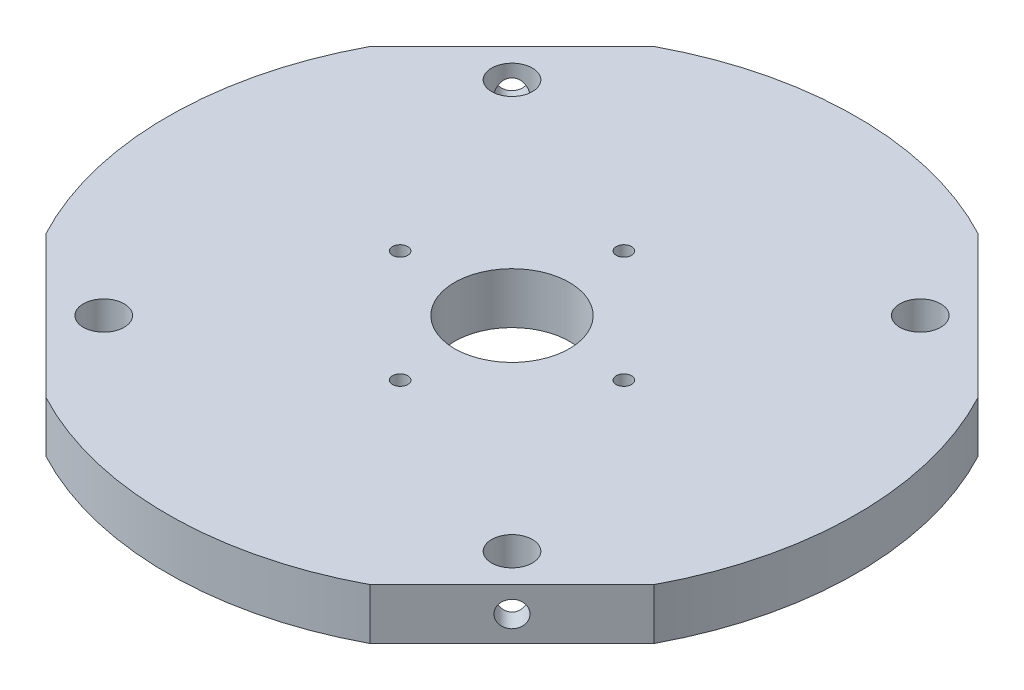
from build123d import *

# Parameters (mm, degrees)
SKETCH1_R                  = 67.5
BOSS_EXTRUDE1_DEPTH        = 10
CUT_EXTRUDE1_DEPTH         = 96.981769102
CUT_EXTRUDE1_DEPTH_BACK    = 96.981769102
SKETCH4_R                  = 4
CUT_EXTRUDE_THIN1_DEPTH    = 96.981769102
F_5_0MM_DOWEL_HOLE1_REACH  = 162.34
F_5_0MM_DOWEL_HOLE1_BORE_R = 2.5
CIRPATTERN1_COUNT          = 4
F_3_0MM_DOWEL_HOLE1_D      = 3
CUT_EXTRUDE2_DEPTH         = 96.981769113
CUT_EXTRUDE2_DEPTH_BACK    = 96.981769113
SKETCH13_R                 = 11.25


with BuildPart() as part:
    # Sketch1 → Boss-Extrude1 (new body)
    with BuildSketch(Plane(origin=(0, 0, 0), x_dir=(1, 0, 0), z_dir=(0, 1, 0))):
        with Locations(Location((0, 0, 0), (0, 0, 270))):
            Circle(SKETCH1_R)
    extrude(amount=BOSS_EXTRUDE1_DEPTH)

    # Sketch4 → Cut-Extrude1 (cut, two sides: drawn at the far end of the back side and taken through both)
    with BuildSketch(Plane(origin=(0, 10, 0), x_dir=(1, 0, 0), z_dir=(0, 1, 0)).offset(-CUT_EXTRUDE1_DEPTH_BACK)):
        with Locations(Location((-40, 40, 0), (0, 0, 270))):
            Circle(SKETCH4_R)
        with Locations(Location((40, 40, 0), (0, 0, 270))):
            Circle(SKETCH4_R)
        with Locations(Location((40, -40, 0), (0, 0, 270))):
            Circle(SKETCH4_R)
        with Locations(Location((-40, -40, 0), (0, 0, 270))):
            Circle(SKETCH4_R)
    extrude(amount=CUT_EXTRUDE1_DEPTH + CUT_EXTRUDE1_DEPTH_BACK, mode=Mode.SUBTRACT)

    # Sketch5 → Cut-Extrude-Thin1 (cut, through all)
    with BuildSketch(Plane(origin=(0, 10, 0), x_dir=(1, 0, 0), z_dir=(0, 1, 0))):
        Polygon((-31.743671291, 59.570037208), (-59.570037208, 31.743671291), (-66.64110502, 38.814739103), (-38.814739103, 66.64110502), align=None)
        Polygon((59.570037208, 31.743671291), (31.743671291, 59.570037208), (38.814739103, 66.64110502), (66.64110502, 38.814739103), align=None)
        Polygon((31.743671291, -59.570037208), (59.570037208, -31.743671291), (66.64110502, -38.814739103), (38.814739103, -66.64110502), align=None)
        Polygon((-59.570037208, -31.743671291), (-31.743671291, -59.570037208), (-38.814739103, -66.64110502), (-66.64110502, -38.814739103), align=None)
    extrude(amount=-CUT_EXTRUDE_THIN1_DEPTH, mode=Mode.SUBTRACT)

    # Ø5.0mm Dowel Hole1 bore → Ø5.0mm Dowel Hole1 (cut, up to next)
    with BuildSketch(Plane(origin=(45.656854249, 0, 45.656854249), x_dir=(0.7071067811865479, 0, -0.7071067811865471), z_dir=(0.7071067811865471, 0, 0.7071067811865479)), mode=Mode.PRIVATE) as f_5_0mm_dowel_hole1_sk1:
        with Locations((0, 5)):
            Circle(F_5_0MM_DOWEL_HOLE1_BORE_R)
    f_5_0mm_dowel_hole1_tool1 = extrude(f_5_0mm_dowel_hole1_sk1.sketch, amount=-F_5_0MM_DOWEL_HOLE1_REACH, mode=Mode.PRIVATE) & part.part
    f_5_0mm_dowel_hole1 = f_5_0mm_dowel_hole1_tool1.solids().sort_by_distance((45.656854, 5, 45.656854))[0]
    add(f_5_0mm_dowel_hole1, mode=Mode.SUBTRACT)

    # CirPattern1: Ø5.0mm Dowel Hole1 ×4 about axis
    cirpattern1_axis = Axis((0, 10, 0), (0, -1, 0))
    for i in range(1, CIRPATTERN1_COUNT):
        add(f_5_0mm_dowel_hole1.rotate(cirpattern1_axis, i * 360 / CIRPATTERN1_COUNT), mode=Mode.SUBTRACT)

    # Ø3.0mm Dowel Hole1 (through all)
    with Locations(Plane(origin=(0, 0, 0), x_dir=(-1, 0, 0), z_dir=(0, -1, 0))):
        with Locations((0, 21.920310217), (21.920310217, 0), (-21.920310217, 0), (0, -21.920310217)):
            Hole(F_3_0MM_DOWEL_HOLE1_D / 2)

    # Sketch13 → Cut-Extrude2 (cut, two sides: drawn at the far end of the back side and taken through both)
    with BuildSketch(Plane(origin=(0, 10, 0), x_dir=(1, 0, 0), z_dir=(0, 1, 0)).offset(-CUT_EXTRUDE2_DEPTH_BACK)):
        with Locations(Location((0, 0, 0), (0, 0, 270))):
            Circle(SKETCH13_R)
    extrude(amount=CUT_EXTRUDE2_DEPTH + CUT_EXTRUDE2_DEPTH_BACK, mode=Mode.SUBTRACT)


solid = part.part
